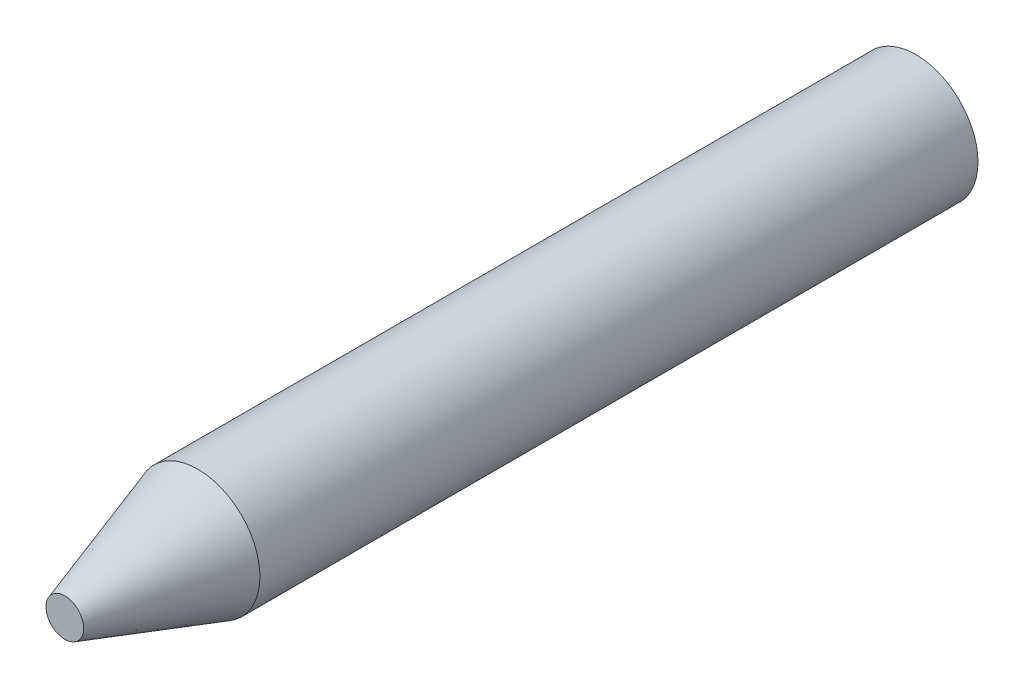
from build123d import *

# Parameters (mm, degrees)
SKETCH1_R           = 7
BOSS_EXTRUDE1_DEPTH = 96
CHAMFER1_SIZE       = 15
CHAMFER1_SIZE2      = 4.873795443


with BuildPart() as part:
    # Sketch1 → Boss-Extrude1 (new body)
    with BuildSketch(Plane.XY):
        Circle(SKETCH1_R)
    extrude(amount=BOSS_EXTRUDE1_DEPTH)

    # Chamfer1
    chamfer1_edges = [part.edges().sort_by_distance(p)[0] for p in [
        (-7, 0, 96),
    ]]
    chamfer1_side = [part.faces().sort_by_distance(p)[0] for p in [
        (-7, 0, 48),
    ]]
    chamfer(chamfer1_edges, length=CHAMFER1_SIZE, length2=CHAMFER1_SIZE2, reference=chamfer1_side[0])


solid = part.part
